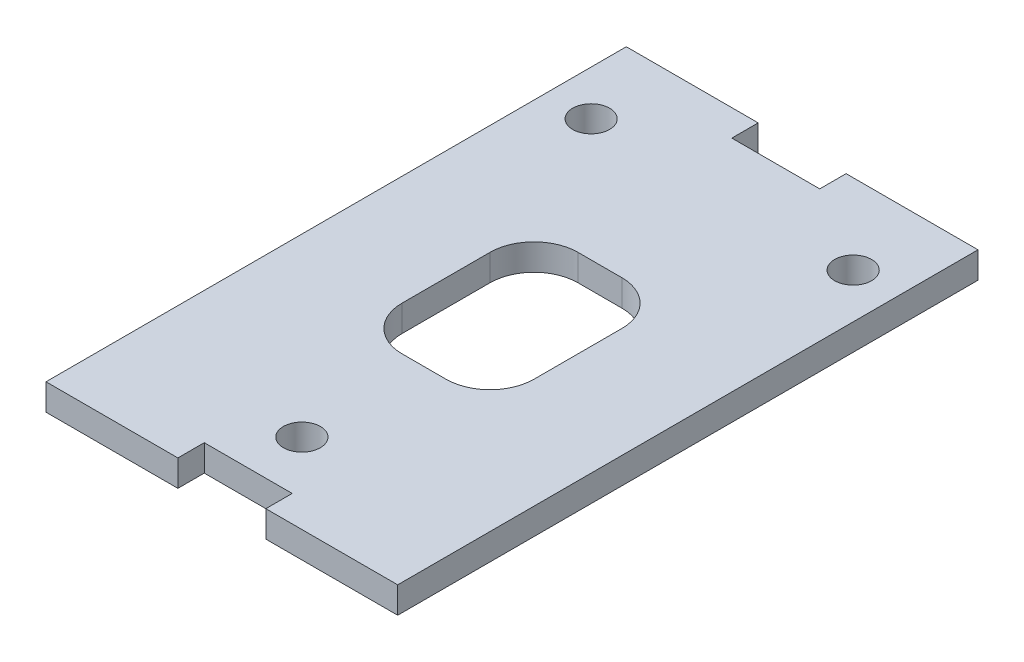
from build123d import *

# Parameters (mm, degrees)
SKETCH1_R           = 2.1
BOSS_EXTRUDE1_DEPTH = 3
SKETCH3_W           = 15
SKETCH3_H           = 20
CUT_EXTRUDE1_DEPTH  = 78.233412459
FILLET1_R           = 5


with BuildPart() as part:
    # Sketch1 → Boss-Extrude1 (new body)
    with BuildSketch(Plane(origin=(0, 0, 0), x_dir=(1, 0, 0), z_dir=(0, 1, 0))):
        Polygon((0, 0), (15, 0), (15, 3), (25, 3), (25, 0), (40, 0), (40, 66), (25, 66), (25, 63), (15, 63), (15, 66), (0, 66), align=None)
        with Locations(Location((34.9, 56.9, 0), (0, 0, 270))):
            Circle(SKETCH1_R, mode=Mode.SUBTRACT)
        with Locations(Location((20, 9.1, 0), (0, 0, 270))):
            Circle(SKETCH1_R, mode=Mode.SUBTRACT)
        with Locations(Location((5.1, 56.9, 0), (0, 0, 270))):
            Circle(SKETCH1_R, mode=Mode.SUBTRACT)
    extrude(amount=BOSS_EXTRUDE1_DEPTH)

    # Sketch3 → Cut-Extrude1 (cut, through all)
    with BuildSketch(Plane(origin=(0, 3, 0), x_dir=(1, 0, 0), z_dir=(0, 1, 0))):
        with Locations((20, 33)):
            Rectangle(SKETCH3_W, SKETCH3_H)
    extrude(amount=-CUT_EXTRUDE1_DEPTH, mode=Mode.SUBTRACT)

    # Fillet1
    fillet1_edges = [part.edges().sort_by_distance(p)[0] for p in [
        (12.5, 1.5, -23),
        (12.5, 1.5, -43),
        (27.5, 1.5, -43),
        (27.5, 1.5, -23),
    ]]
    fillet(fillet1_edges, radius=FILLET1_R)


solid = part.part
